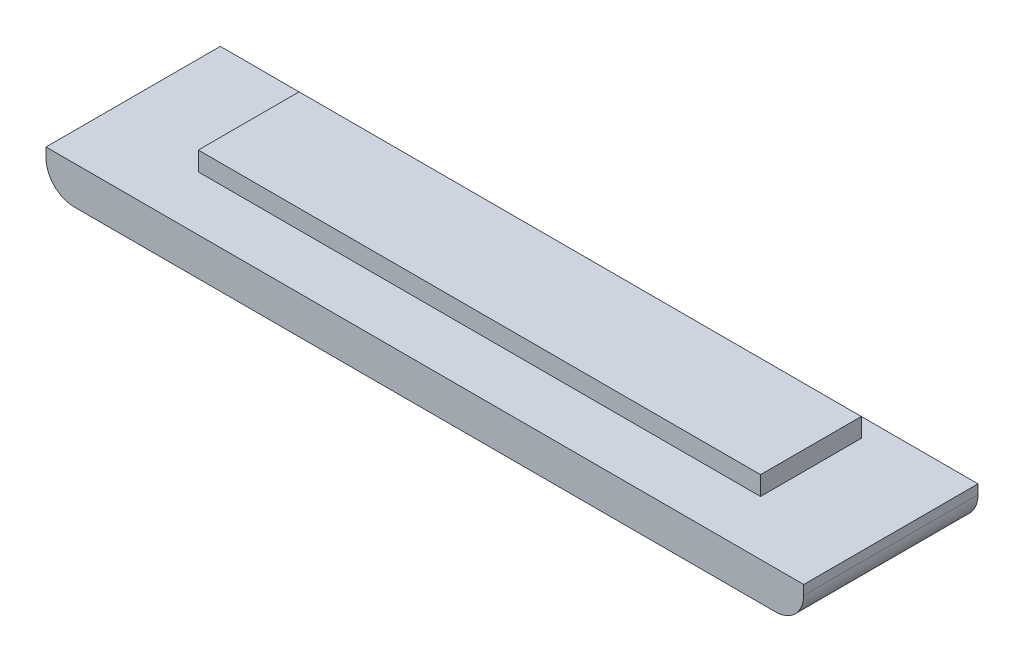
from build123d import *

# Parameters (mm, degrees)
SKETCH1_W           = 254
SKETCH1_H           = 58.42
BOSS_EXTRUDE1_DEPTH = 19.05
CUT_EXTRUDE1_DEPTH  = 6.35
FILLET1_R           = 9.525


with BuildPart() as part:
    # Sketch1 → Boss-Extrude1 (new body)
    with BuildSketch(Plane(origin=(0, 0, 0), x_dir=(1, 0, 0), z_dir=(0, 1, 0))):
        with Locations((127, 29.21)):
            Rectangle(SKETCH1_W, SKETCH1_H)
    extrude(amount=BOSS_EXTRUDE1_DEPTH)

    # Sketch2 → Cut-Extrude1 (cut)
    with BuildSketch(Plane(origin=(0, 19.05, 0), x_dir=(1, 0, 0), z_dir=(0, 1, 0))):
        Polygon((221.234, 52.07), (221.234, 18.288), (127, 18.288), (127, 0), (254, 0), (254, 58.42), (127, 58.42), (127, 52.07), align=None)
        Polygon((127, 0), (127, 18.288), (32.766, 18.288), (32.766, 52.07), (127, 52.07), (127, 58.42), (0, 58.42), (0, 0), align=None)
    extrude(amount=-CUT_EXTRUDE1_DEPTH, mode=Mode.SUBTRACT)

    # Fillet1
    fillet1_edges = [part.edges().sort_by_distance(p)[0] for p in [
        (254, 0, -29.21),
        (0, 0, -29.21),
    ]]
    fillet(fillet1_edges, radius=FILLET1_R)


solid = part.part
